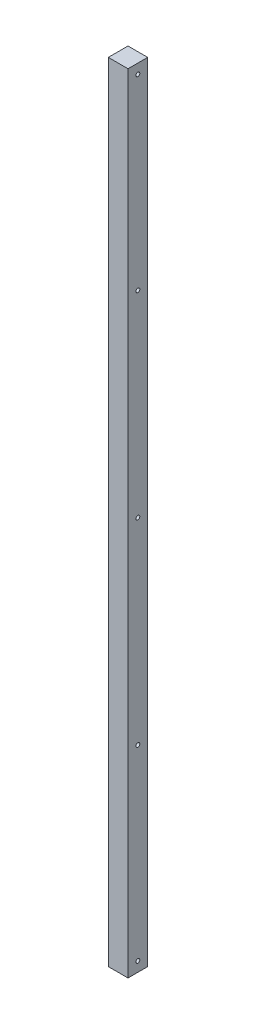
from build123d import *

# Parameters (mm, degrees)
SKETCH_1_W          = 50
SKETCH_1_H          = 50
EXTRUDE_2_DEPTH     = 2000
SKETCH_2_R          = 5
CUT_EXTRUDE_1_DEPTH = 2001.781097472
SKETCH_3_R          = 5
CUT_EXTRUDE_2_DEPTH = 2001.781097472
SKETCH_4_R          = 5
CUT_EXTRUDE_3_DEPTH = 2001.781097472


with BuildPart() as part:
    # Эскиз1 → Бобышка-Вытянуть2 (new body)
    with BuildSketch(Plane(origin=(0, 0, 0), x_dir=(1, 0, 0), z_dir=(0, 1, 0))):
        Rectangle(SKETCH_1_W, SKETCH_1_H)
    extrude(amount=EXTRUDE_2_DEPTH)

    # Эскиз2 → Вырез-Вытянуть1 (cut, through all)
    with BuildSketch(Plane(origin=(25, 0, 0), x_dir=(0, 0, -1), z_dir=(1, 0, 0))):
        with Locations((0, 1975)):
            Circle(SKETCH_2_R)
        with Locations((0, 25)):
            Circle(SKETCH_2_R)
    extrude(amount=-CUT_EXTRUDE_1_DEPTH, mode=Mode.SUBTRACT)

    # Эскиз3 → Вырез-Вытянуть2 (cut, through all)
    with BuildSketch(Plane(origin=(25, 0, 0), x_dir=(0, 0, -1), z_dir=(1, 0, 0))):
        with Locations((0, 1000)):
            Circle(SKETCH_3_R)
    extrude(amount=-CUT_EXTRUDE_2_DEPTH, mode=Mode.SUBTRACT)

    # Эскиз4 → Вырез-Вытянуть3 (cut, through all)
    with BuildSketch(Plane(origin=(25, 0, 0), x_dir=(0, 0, -1), z_dir=(1, 0, 0))):
        with Locations((0, 1500)):
            Circle(SKETCH_4_R)
        with Locations((0, 500)):
            Circle(SKETCH_4_R)
    extrude(amount=-CUT_EXTRUDE_3_DEPTH, mode=Mode.SUBTRACT)


solid = part.part
